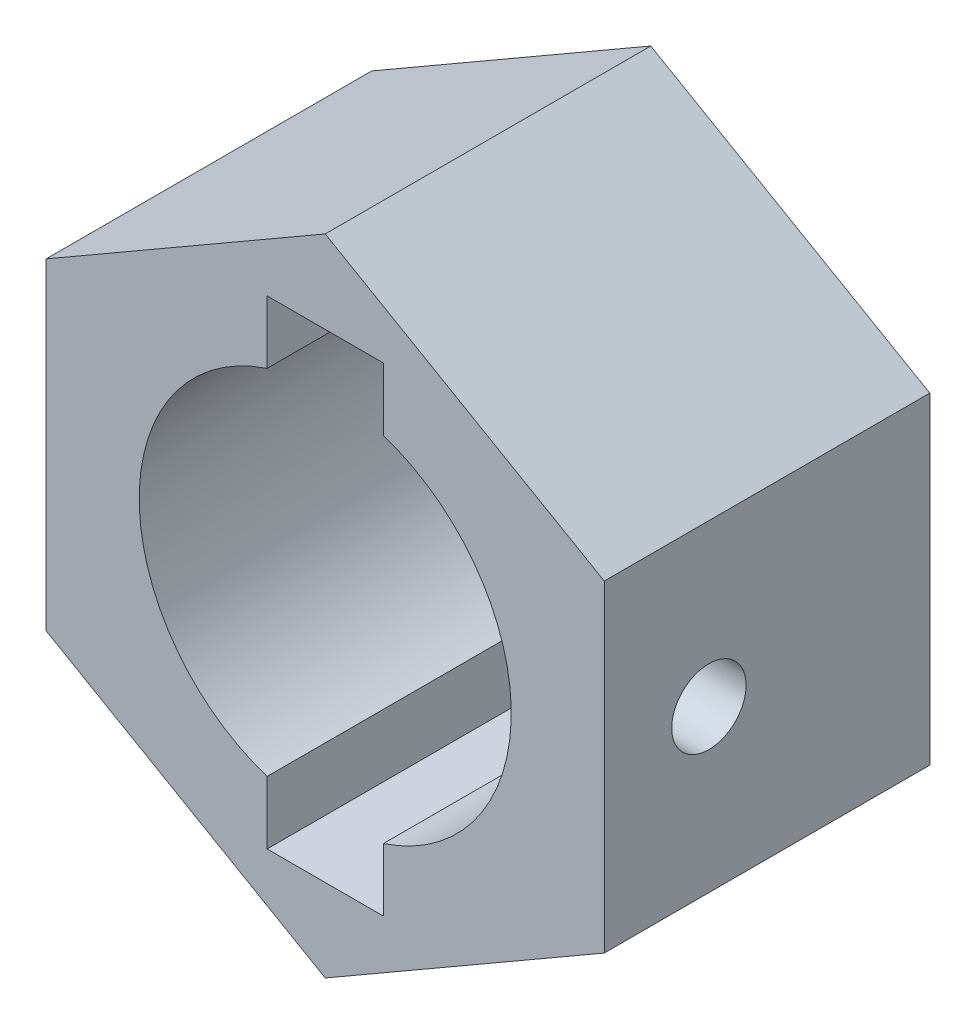
from build123d import *

# Parameters (mm, degrees)
BOSS_EXTRUDE1_DEPTH        = 14
M3_CLEARANCE_HOLE1_REACH   = 33.048
M3_CLEARANCE_HOLE1_BORE_R  = 1.6
M2X0_4_TAPPED_HOLE1_REACH  = 33.048
M2X0_4_TAPPED_HOLE1_BORE_R = 0.8


with BuildPart() as part:
    # Sketch1 → Boss-Extrude1 (new body)
    with BuildSketch(Plane.XY):
        Polygon((12, 6.92820323), (0, 13.856406461), (-12, 6.92820323), (-12, -6.92820323), (0, -13.856406461), (12, -6.92820323), align=None)
        with BuildLine():
            ThreePointArc((-2.5, -7.599342077), (-8, 0), (-2.5, 7.599342077))
            Line((-2.5, 7.599342077), (-2.5, 10.3))
            Line((-2.5, 10.3), (2.5, 10.3))
            Line((2.5, 10.3), (2.5, 7.599342077))
            ThreePointArc((2.5, 7.599342077), (6.480740698, 4.69041576), (8, 0))
            ThreePointArc((8, 0), (6.480740698, -4.69041576), (2.5, -7.599342077))
            Line((2.5, -7.599342077), (2.5, -10.3))
            Line((2.5, -10.3), (-2.5, -10.3))
            Line((-2.5, -10.3), (-2.5, -7.599342077))
        make_face(mode=Mode.SUBTRACT)
    extrude(amount=BOSS_EXTRUDE1_DEPTH)

    # M3 Clearance Hole1 bore → M3 Clearance Hole1 (cut, up to next)
    with BuildSketch(Plane(origin=(12, 0, 0), x_dir=(0, 0, -1), z_dir=(1, 0, 0)), mode=Mode.PRIVATE) as m3_clearance_hole1_sk1:
        with Locations((-9.5, 0)):
            Circle(M3_CLEARANCE_HOLE1_BORE_R)
    m3_clearance_hole1_tool1 = extrude(m3_clearance_hole1_sk1.sketch, amount=-M3_CLEARANCE_HOLE1_REACH, mode=Mode.PRIVATE) & part.part
    add(m3_clearance_hole1_tool1.solids().sort_by_distance((12, 0, 9.5))[0], mode=Mode.SUBTRACT)

    # M2x0.4 Tapped Hole1 bore → M2x0.4 Tapped Hole1 (cut, up to next)
    with BuildSketch(Plane.ZY.offset(12), mode=Mode.PRIVATE) as m2x0_4_tapped_hole1_sk1:
        with Locations((2, 0)):
            Circle(M2X0_4_TAPPED_HOLE1_BORE_R)
    m2x0_4_tapped_hole1_tool1 = extrude(m2x0_4_tapped_hole1_sk1.sketch, amount=-M2X0_4_TAPPED_HOLE1_REACH, mode=Mode.PRIVATE) & part.part
    add(m2x0_4_tapped_hole1_tool1.solids().sort_by_distance((-12, 0, 2))[0], mode=Mode.SUBTRACT)


solid = part.part
